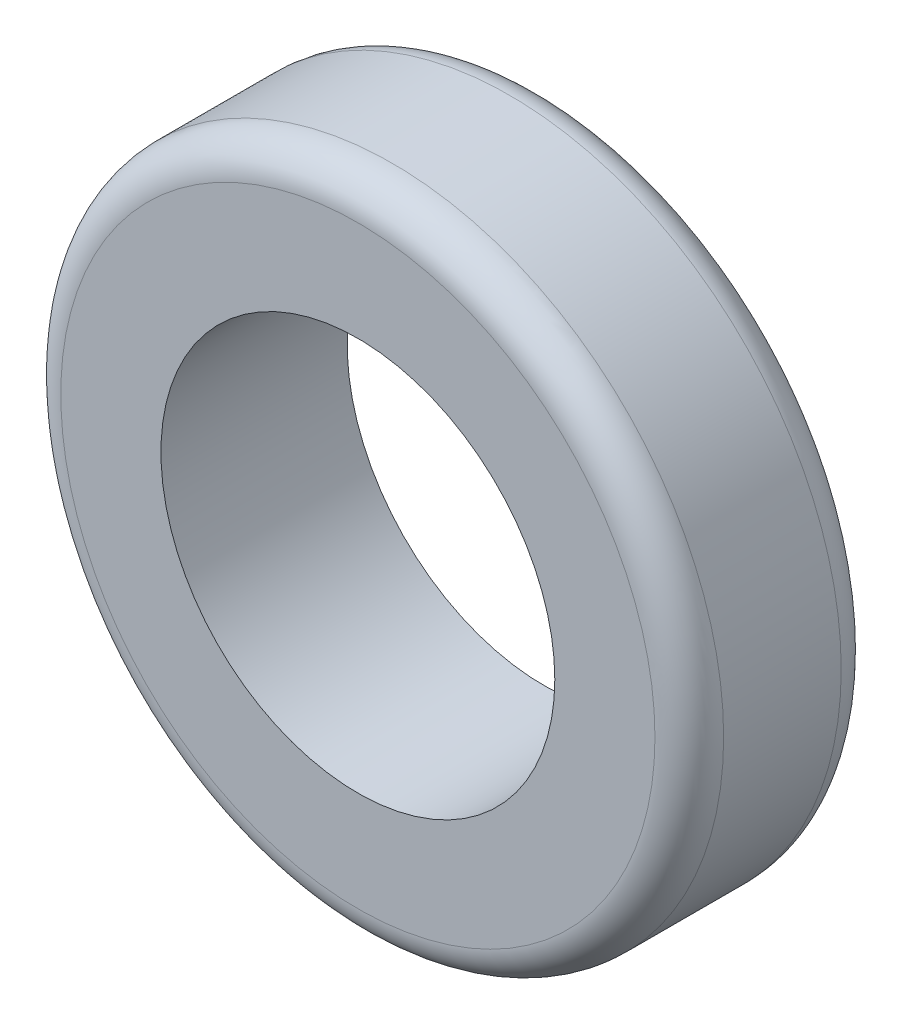
from build123d import *

# Parameters (mm, degrees)
SKETCH_3_R          = 96.5
EXTRUDE_1_DEPTH     = 54.23
FILLET_1_R          = 10
SKETCH_4_R          = 57.34
CUT_EXTRUDE_1_DEPTH = 54.23


with BuildPart() as part:
    # 草图3 → 凸台-拉伸1 (new body)
    with BuildSketch(Plane.XY):
        with Locations((58.742605219, 48.942624637)):
            Circle(SKETCH_3_R)
    extrude(amount=EXTRUDE_1_DEPTH)

    # 圆角1
    fillet_1_edges = [part.edges().sort_by_distance(p)[0] for p in [
        (-37.757394781, 48.942624637, 0),
        (-37.757394781, 48.942624637, 54.23),
    ]]
    fillet(fillet_1_edges, radius=FILLET_1_R)

    # 草图4 → 切除-拉伸1 (cut)
    with BuildSketch(Plane.XY.offset(54.23)):
        with Locations((58.742605219, 48.942624637)):
            Circle(SKETCH_4_R)
    extrude(amount=-CUT_EXTRUDE_1_DEPTH, mode=Mode.SUBTRACT)


solid = part.part
